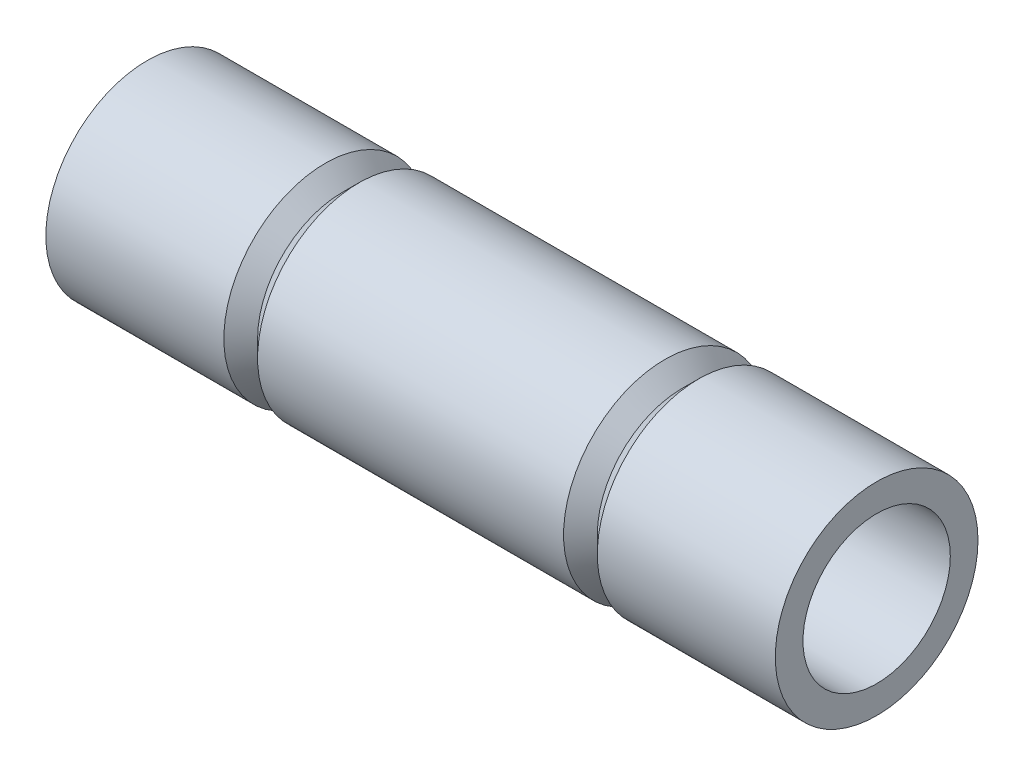
from build123d import *


with BuildPart() as part:
    # Sketch1 → Revolve1 (revolve)
    with BuildSketch(Plane(origin=(0, 0, 0), x_dir=(1, 0, 0), z_dir=(0, 1, 0)), mode=Mode.PRIVATE) as revolve1_sk:
        Polygon((75.692, -15.2908), (-75.692, -15.2908), (-75.692, -21.034375), (-38.75, -21.034375), (-35.25, -17.534375), (-31.75, -21.034375), (31.75, -21.034375), (35.25, -17.534375), (38.75, -21.034375), (75.692, -21.034375), align=None)
    revolve(revolve1_sk.sketch.rotate(Axis((0, 0, 0), (-1, 0, 0)), 180), axis=Axis((0, 0, 0), (-1, 0, 0)))


solid = part.part
